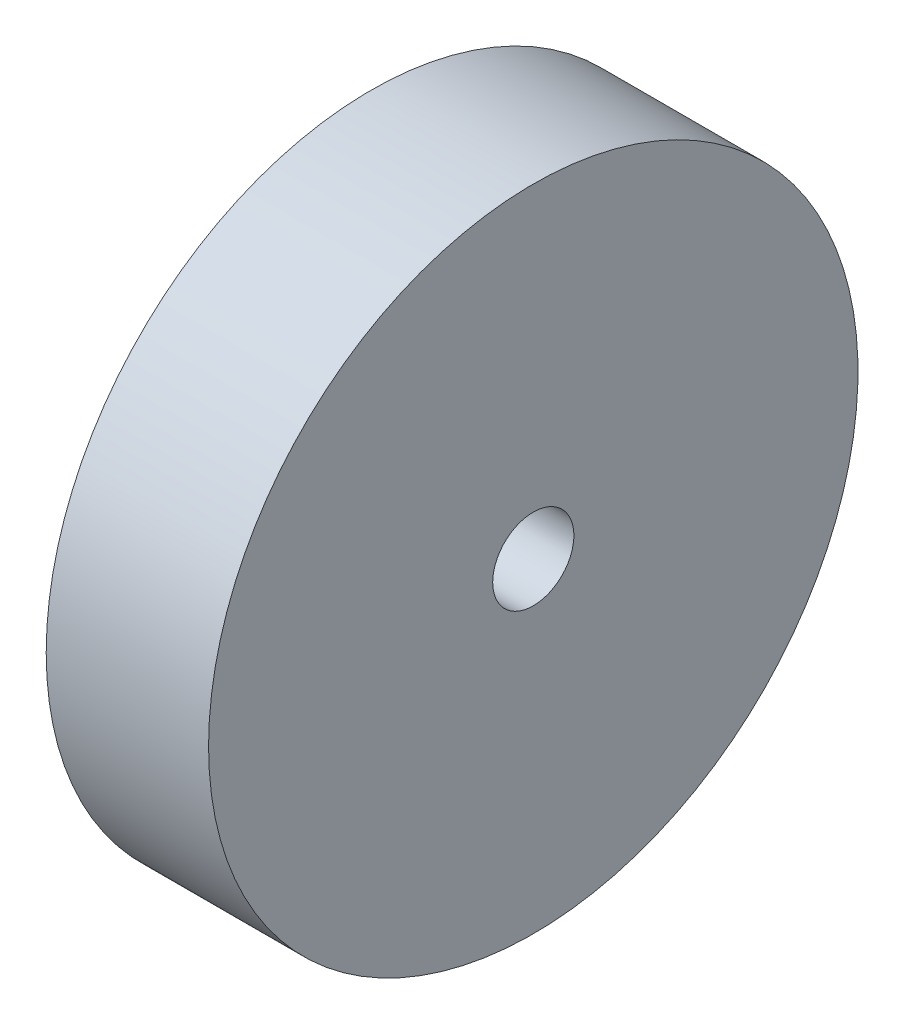
from build123d import *

# Parameters (mm, degrees)
SKETCH1_W = 12.7
SKETCH1_H = 22.225


with BuildPart() as part:
    # Sketch1 → Revolve2 (revolve)
    with BuildSketch(Plane.XY, mode=Mode.PRIVATE) as revolve2_sk:
        with Locations((0, 14.2875)):
            Rectangle(SKETCH1_W, SKETCH1_H)
    revolve(revolve2_sk.sketch.rotate(Axis((-6.35, 0, 0), (1, 0, 0)), 90), axis=Axis((-6.35, 0, 0), (1, 0, 0)))


solid = part.part
